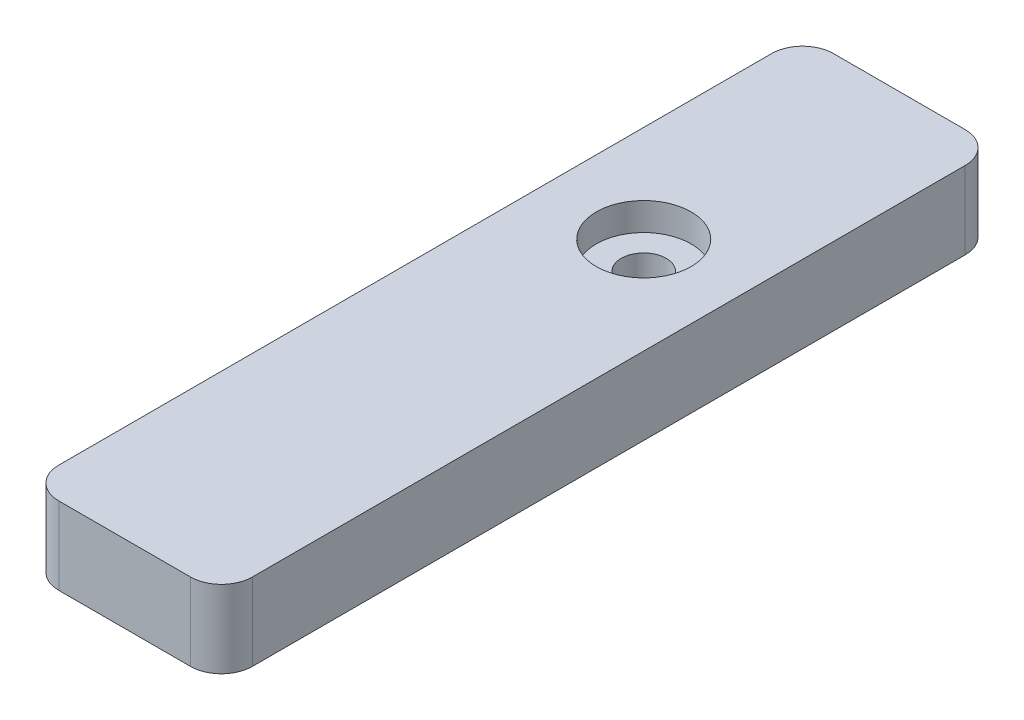
from build123d import *

# Parameters (mm, degrees)
SKETCH1_W                               = 25
SKETCH1_H                               = 100
BOSS_EXTRUDE1_DEPTH                     = 10
CBORE_FOR_M5_HEX_HEAD_BOLT1_D           = 5.8
CBORE_FOR_M5_HEX_HEAD_BOLT1_CBORE_D     = 12.24
CBORE_FOR_M5_HEX_HEAD_BOLT1_CBORE_DEPTH = 3.58
FILLET1_R                               = 4


with BuildPart() as part:
    # Sketch1 → Boss-Extrude1 (new body)
    with BuildSketch(Plane(origin=(0, 0, 0), x_dir=(1, 0, 0), z_dir=(0, 1, 0))):
        with Locations((12.5, 50)):
            Rectangle(SKETCH1_W, SKETCH1_H)
    extrude(amount=BOSS_EXTRUDE1_DEPTH)

    # CBORE for M5 Hex Head Bolt1 (through all)
    with Locations(Plane(origin=(0, 10, 0), x_dir=(1, 0, 0), z_dir=(0, 1, 0))):
        with Locations((12.5, 67)):
            CounterBoreHole(CBORE_FOR_M5_HEX_HEAD_BOLT1_D / 2, CBORE_FOR_M5_HEX_HEAD_BOLT1_CBORE_D / 2, CBORE_FOR_M5_HEX_HEAD_BOLT1_CBORE_DEPTH)

    # Fillet1
    fillet1_edges = [part.edges().sort_by_distance(p)[0] for p in [
        (0, 5, -100),
        (25, 5, -100),
        (25, 5, 0),
        (0, 5, 0),
    ]]
    fillet(fillet1_edges, radius=FILLET1_R)


solid = part.part
